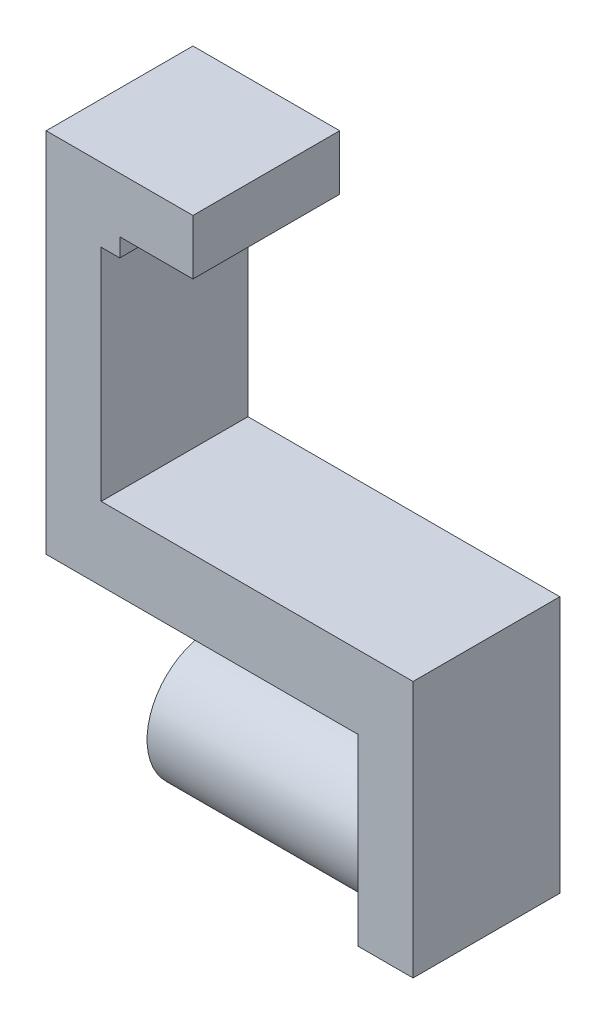
from build123d import *

# Parameters (mm, degrees)
SKETCH1_R                = 11.1125
BOSS_EXTRUDE1_DEPTH      = 38.1
BOSS_EXTRUDE2_DEPTH      = 12.7
BOSS_EXTRUDE2_DEPTH_BACK = 12.7
SKETCH2_W                = 9.525
SKETCH2_H                = 31.75
BOSS_EXTRUDE3_DEPTH      = 12.7
BOSS_EXTRUDE3_DEPTH_BACK = 12.7
SKETCH3_W                = 63.5
SKETCH3_H                = 12.7
BOSS_EXTRUDE4_DEPTH      = 12.7
BOSS_EXTRUDE4_DEPTH_BACK = 12.7
SKETCH4_W                = 9.525
SKETCH4_H                = 63.5
BOSS_EXTRUDE5_DEPTH      = 12.7
BOSS_EXTRUDE5_DEPTH_BACK = 12.7


with BuildPart() as part:
    # Sketch1 → Boss-Extrude1 (new body)
    with BuildSketch(Plane(origin=(0, 0, 0), x_dir=(0, 0, -1), z_dir=(1, 0, 0))):
        Circle(SKETCH1_R)
    extrude(amount=-BOSS_EXTRUDE1_DEPTH)

    # Sketch2 → Boss-Extrude2 (add, two sides: drawn at the far end of the back side and taken through both)
    with BuildSketch(Plane.XY.offset(-BOSS_EXTRUDE2_DEPTH_BACK)):
        with Locations((4.7625, 4.7625)):
            Rectangle(SKETCH2_W, SKETCH2_H)
    extrude(amount=BOSS_EXTRUDE2_DEPTH + BOSS_EXTRUDE2_DEPTH_BACK)

    # Sketch3 → Boss-Extrude3 (add, two sides: drawn at the far end of the back side and taken through both)
    with BuildSketch(Plane.XY.offset(-BOSS_EXTRUDE3_DEPTH_BACK)):
        with Locations((-22.225, 26.9875)):
            Rectangle(SKETCH3_W, SKETCH3_H)
    extrude(amount=BOSS_EXTRUDE3_DEPTH + BOSS_EXTRUDE3_DEPTH_BACK)

    # Sketch4 → Boss-Extrude4 (add, two sides: drawn at the far end of the back side and taken through both)
    with BuildSketch(Plane.XY.offset(-BOSS_EXTRUDE4_DEPTH_BACK)):
        with Locations((-49.2125, 52.3875)):
            Rectangle(SKETCH4_W, SKETCH4_H)
    extrude(amount=BOSS_EXTRUDE4_DEPTH + BOSS_EXTRUDE4_DEPTH_BACK)

    # Sketch5 → Boss-Extrude5 (add, two sides: drawn at the far end of the back side and taken through both)
    with BuildSketch(Plane.XY.offset(-BOSS_EXTRUDE5_DEPTH_BACK)):
        Polygon((-53.975, 71.4375), (-41.23944, 71.4375), (-41.23944, 74.6125), (-28.575, 74.6125), (-28.575, 84.1375), (-53.975, 84.1375), align=None)
    extrude(amount=BOSS_EXTRUDE5_DEPTH + BOSS_EXTRUDE5_DEPTH_BACK)


solid = part.part
